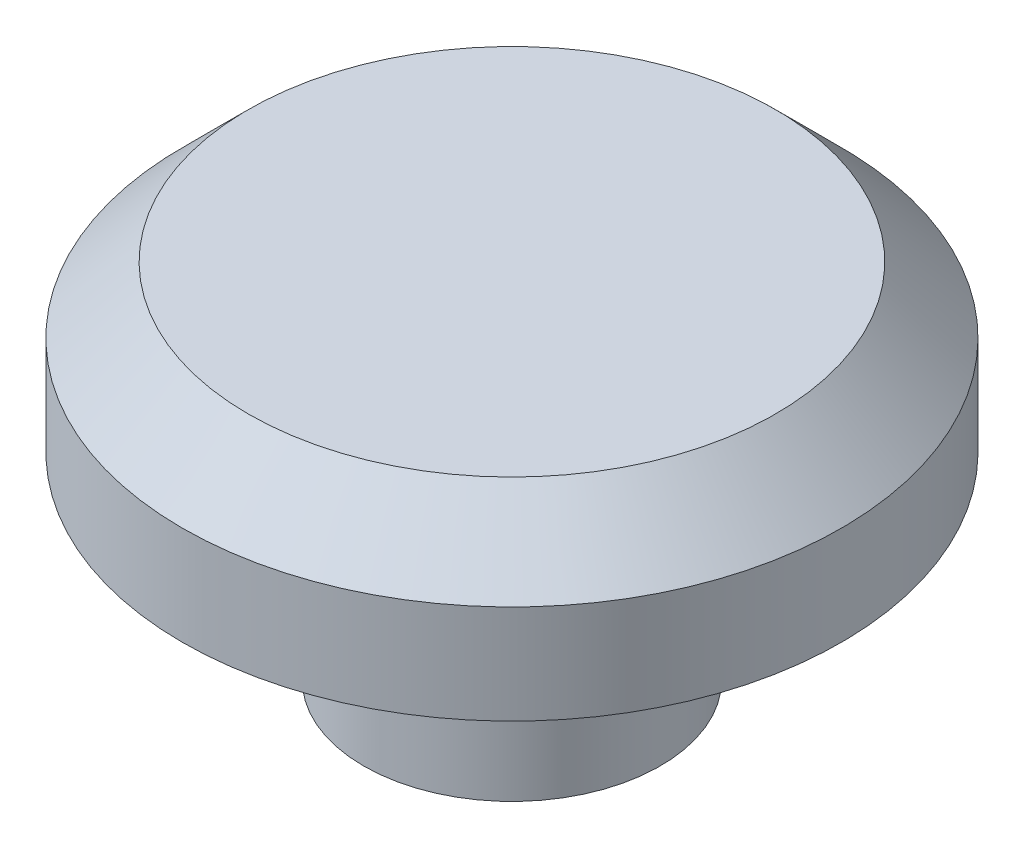
from build123d import *

# Parameters (mm, degrees)
SKETCH_2_R      = 10
EXTRUDE_1_DEPTH = 5
SKETCH_3_R      = 4.5
EXTRUDE_2_DEPTH = 11
CHAMFER_1_SIZE  = 2


with BuildPart() as part:
    # 草圖2 → 填料-伸長1 (new body)
    with BuildSketch(Plane(origin=(0, 0, 0), x_dir=(1, 0, 0), z_dir=(0, 1, 0))):
        with Locations(Location((0, 0, 0), (0, 0, 270))):
            Circle(SKETCH_2_R)
    extrude(amount=-EXTRUDE_1_DEPTH)

    # 草圖3 → 填料-伸長2 (add)
    with BuildSketch(Plane(origin=(0, 0, 0), x_dir=(1, 0, 0), z_dir=(0, 1, 0))):
        with Locations(Location((0, 0, 0), (0, 0, 270))):
            Circle(SKETCH_3_R)
    extrude(amount=-EXTRUDE_2_DEPTH)

    # 導角1
    chamfer_1_edges = [part.edges().sort_by_distance(p)[0] for p in [
        (0, 0, -10),
    ]]
    chamfer(chamfer_1_edges, length=CHAMFER_1_SIZE)


solid = part.part
